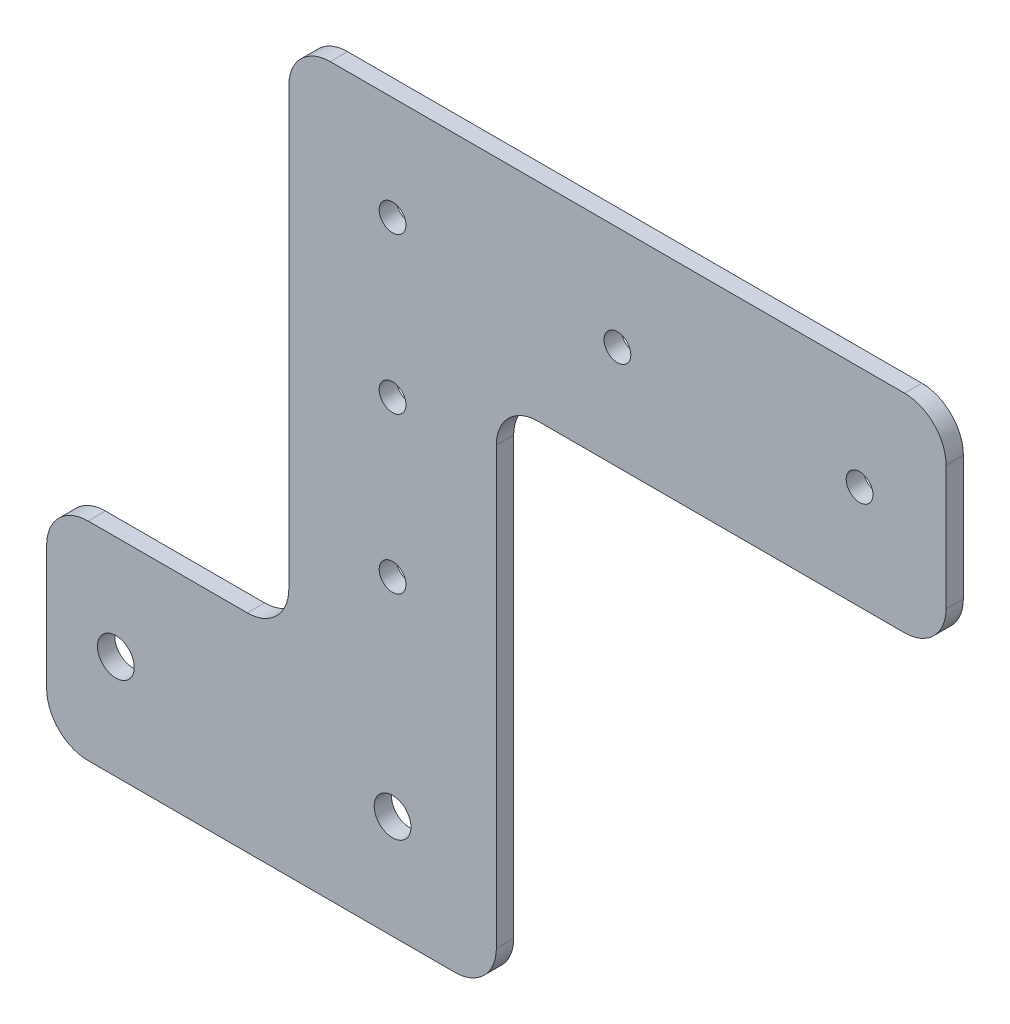
from build123d import *

# Parameters (mm, degrees)
BOSS_EXTRUDE1_DEPTH          = 3.175
F_10_0_1935_DIAMETER_HOLE1_D = 4.9149
F_1_4_CLEARANCE_HOLE2_D      = 6.7564
FILLET1_R                    = 7.62


with BuildPart() as part:
    # Sketch1 → Boss-Extrude1 (new body)
    with BuildSketch(Plane.XY):
        Polygon((0, 0), (82.55, 0), (82.55, 95.25), (165.1, 95.25), (165.1, 133.35), (44.45, 133.35), (44.45, 38.1), (0, 38.1), align=None)
    extrude(amount=BOSS_EXTRUDE1_DEPTH)

    # #10 (0.1935) Diameter Hole1 (through all)
    with Locations(Plane.XY.offset(3.175)):
        with Locations((63.5, 85.725), (63.5, 57.15), (63.5, 114.3), (149.225, 114.3), (104.775, 114.3)):
            Hole(F_10_0_1935_DIAMETER_HOLE1_D / 2)

    # 1/4 Clearance Hole2 (through all)
    with Locations(Plane.XY.offset(3.175)):
        with Locations((12.7, 19.05), (63.5, 19.05)):
            Hole(F_1_4_CLEARANCE_HOLE2_D / 2)

    # Fillet1
    fillet1_edges = [part.edges().sort_by_distance(p)[0] for p in [
        (0, 38.1, 1.5875),
        (44.45, 38.1, 1.5875),
        (44.45, 133.35, 1.5875),
        (165.1, 133.35, 1.5875),
        (165.1, 95.25, 1.5875),
        (82.55, 95.25, 1.5875),
        (82.55, 0, 1.5875),
        (0, 0, 1.5875),
    ]]
    fillet(fillet1_edges, radius=FILLET1_R)


solid = part.part
